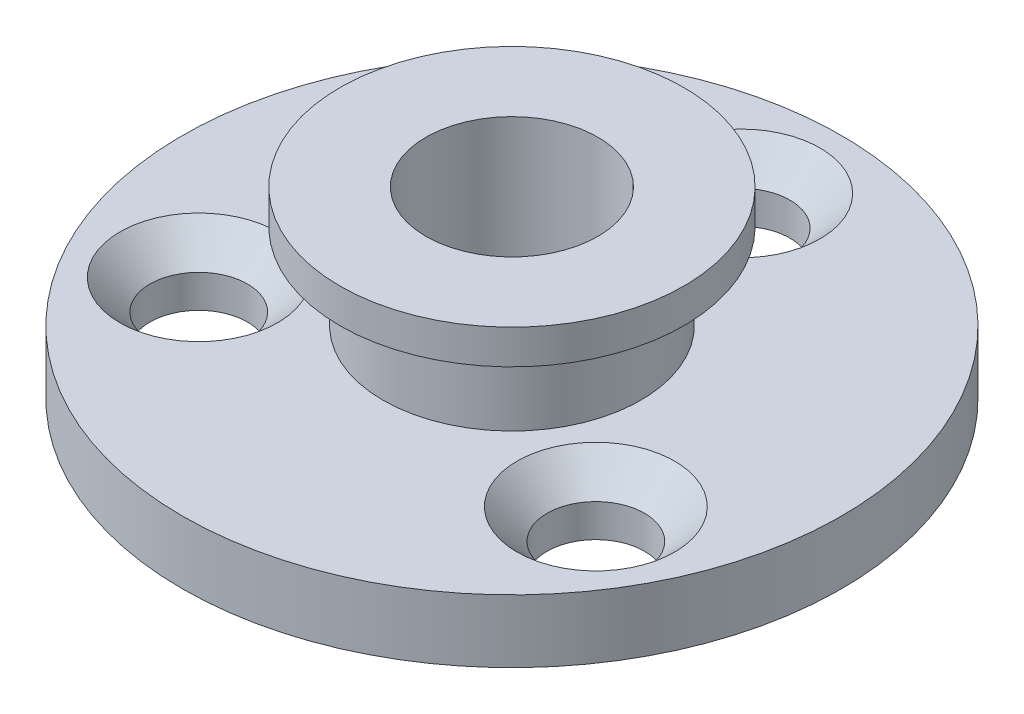
from build123d import *

# Parameters (mm, degrees)
CSK_FOR_M3_FLAT_HEAD_MACHINE_SCREW1_AT_2_COUNT = 2
CSK_FOR_M3_FLAT_HEAD_MACHINE_SCREW1_AT_2_PITCH = 13.856406461
CSK_FOR_M3_FLAT_HEAD_MACHINE_SCREW1_AT_3_COUNT = 2
CSK_FOR_M3_FLAT_HEAD_MACHINE_SCREW1_AT_3_PITCH = 13.856406461


with BuildPart() as part:
    # Esquisse1 → Révolution1 (revolve)
    with BuildSketch(Plane.XY, mode=Mode.PRIVATE) as r_volution1_sk:
        Polygon((3, -3.2), (3, 3.2), (6, 3.2), (6, 2), (4.5, 2), (4.5, -1), (11.5, -1), (11.5, -3.2), align=None)
    revolve(r_volution1_sk.sketch.rotate(Axis((0, 4.689873418, 0), (0, -1, 0)), 90), axis=Axis((0, 4.689873418, 0), (0, -1, 0)))

    # Esquisse4 → CSK for M3 Flat Head Machine Screw1 (revolve, cut)
    with BuildSketch(Plane(origin=(-6.92820323, -1, 4), x_dir=(0, 0, 1), z_dir=(1, 0, 0))):
        Polygon((0, 0), (0, 2.2), (1.7, 2.2), (1.7, 1.05), (2.75, 0), align=None)
    csk_for_m3_flat_head_machine_screw1 = revolve(axis=Axis((-6.92820323, 5.35, 4), (0, -1, 0)), mode=Mode.SUBTRACT)

    # CSK for M3 Flat Head Machine Screw1 at 2: CSK for M3 Flat Head Machine Screw1 ×2
    with Locations(*[(i * CSK_FOR_M3_FLAT_HEAD_MACHINE_SCREW1_AT_2_PITCH, 0, 0) for i in range(1, CSK_FOR_M3_FLAT_HEAD_MACHINE_SCREW1_AT_2_COUNT)]):
        add(csk_for_m3_flat_head_machine_screw1, mode=Mode.SUBTRACT)

    # CSK for M3 Flat Head Machine Screw1 at 3: CSK for M3 Flat Head Machine Screw1 ×2
    with Locations(*[Vector(0.5000000000000041, 0, -0.8660254037844364) * (i * CSK_FOR_M3_FLAT_HEAD_MACHINE_SCREW1_AT_3_PITCH) for i in range(1, CSK_FOR_M3_FLAT_HEAD_MACHINE_SCREW1_AT_3_COUNT)]):
        add(csk_for_m3_flat_head_machine_screw1, mode=Mode.SUBTRACT)


solid = part.part
